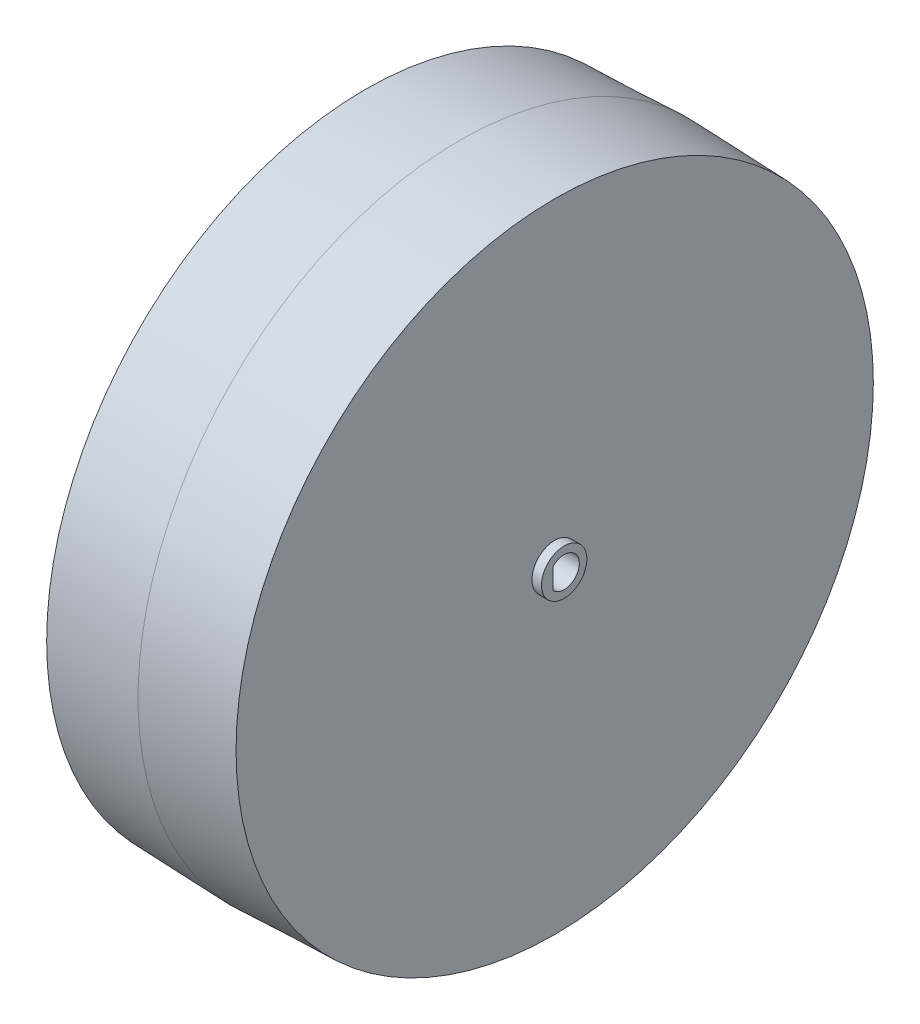
from build123d import *

# Parameters (mm, degrees)
SKETCH1_R                     = 85
BOSS_EXTRUDE1_DEPTH           = 25
BOSS_EXTRUDE1_TAPER           = 2
BOSS_EXTRUDE1_OTHER_WAY_DEPTH = 25
BOSS_EXTRUDE1_OTHER_WAY_TAPER = 2
SKETCH2_R                     = 6
BOSS_EXTRUDE2_DEPTH           = 2.5
CUT_EXTRUDE1_DEPTH            = 14


with BuildPart() as part:
    # Sketch1 → Boss-Extrude1 (new body)
    with BuildSketch(Plane(origin=(0, 0, 0), x_dir=(0, 0, -1), z_dir=(1, 0, 0))):
        Circle(SKETCH1_R)
    extrude(amount=BOSS_EXTRUDE1_DEPTH, taper=BOSS_EXTRUDE1_TAPER)

    # Sketch1 → Boss-Extrude1 other way (add)
    with BuildSketch(Plane(origin=(0, 0, 0), x_dir=(0, 0, -1), z_dir=(1, 0, 0))):
        Circle(SKETCH1_R)
    extrude(amount=-BOSS_EXTRUDE1_OTHER_WAY_DEPTH, taper=BOSS_EXTRUDE1_OTHER_WAY_TAPER)

    # Sketch2 → Boss-Extrude2 (add)
    with BuildSketch(Plane(origin=(25, 0, 0), x_dir=(0, 0, -1), z_dir=(1, 0, 0))):
        Circle(SKETCH2_R)
    extrude(amount=BOSS_EXTRUDE2_DEPTH)

    # Sketch3 → Cut-Extrude1 (cut)
    with BuildSketch(Plane(origin=(27.5, 0, 0), x_dir=(0, 0, -1), z_dir=(1, 0, 0))):
        with BuildLine():
            Line((-3, -2.645751311), (-3, 2.645751311))
            ThreePointArc((-3, 2.645751311), (4, 0), (-3, -2.645751311))
        make_face()
    extrude(amount=-CUT_EXTRUDE1_DEPTH, mode=Mode.SUBTRACT)


solid = part.part
